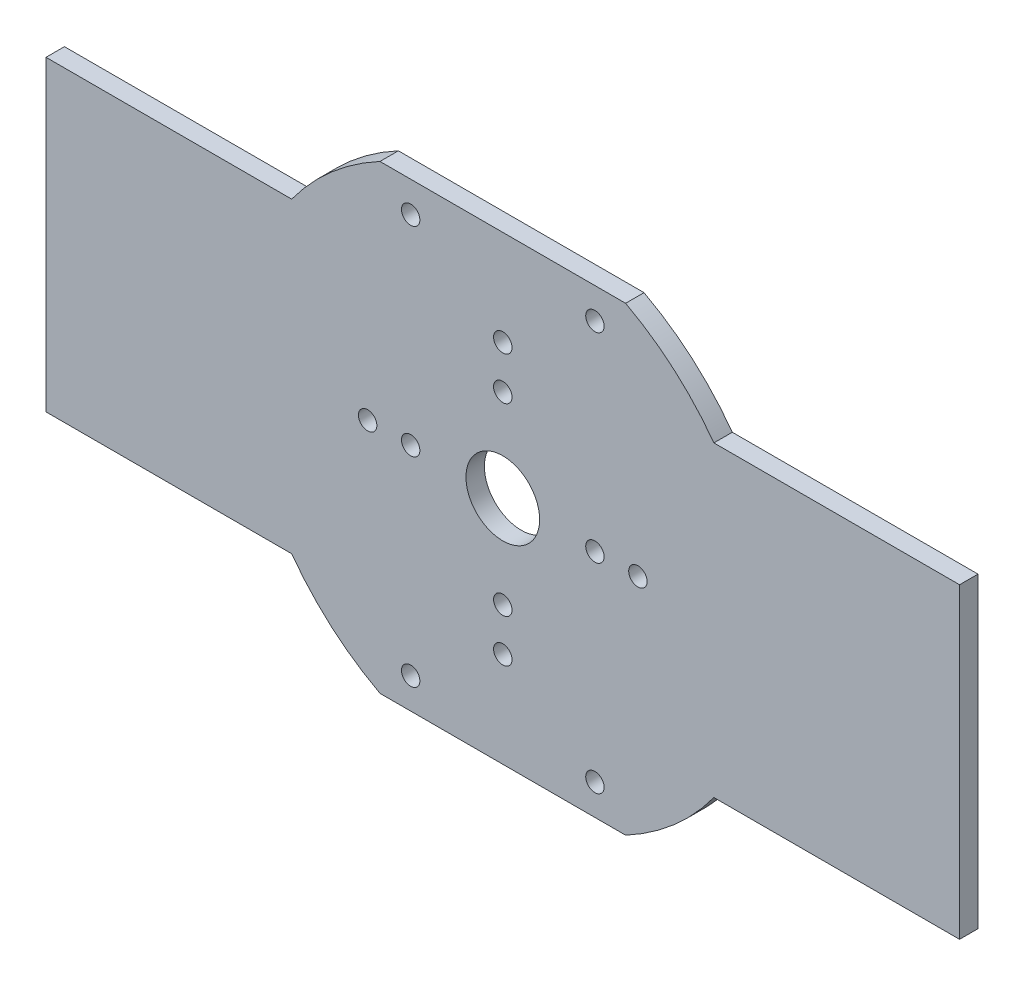
from build123d import *

# Parameters (mm, degrees)
SKETCH_1_R           = 42.5
EXTRUDE_7_DEPTH      = 1.5
CUT_EXTRUDE_24_DEPTH = 1.5
CUT_EXTRUDE_25_DEPTH = 1.5
SKETCH_1_14_R        = 1.5
CUT_EXTRUDE_26_DEPTH = 1.5
SKETCH_1_15_R        = 1.5
CUT_EXTRUDE_27_DEPTH = 1.5
SKETCH_1_16_R        = 1.5
CUT_EXTRUDE_28_DEPTH = 1.5
SKETCH_1_17_R        = 1.5
CUT_EXTRUDE_29_DEPTH = 1.5
SKETCH_10_R          = 1.5
CUT_EXTRUDE_31_DEPTH = 98.67420335
SKETCH_11_R          = 6
CUT_EXTRUDE_32_DEPTH = 98.67420335
CUT_EXTRUDE_35_DEPTH = 5
SKETCH_41_W          = 3
SKETCH_41_H          = 50
EXTRUDE_14_DEPTH     = 40
SKETCH_42_W          = 3
SKETCH_42_H          = 50
EXTRUDE_15_DEPTH     = 40


with BuildPart() as part:
    # 草图1 → 凸台-拉伸7 (new, symmetric)
    with BuildSketch(Plane.XY):
        with Locations((20, -37.5)):
            Circle(SKETCH_1_R)
    extrude(amount=EXTRUDE_7_DEPTH, both=True)

    # 草图1<12> → 切除-拉伸24 (cut, symmetric)
    with BuildSketch(Plane.XY):
        with BuildLine():
            ThreePointArc((40, 0), (20, 5), (0, 0))
            Line((0, 0), (40, 0))
        make_face()
    extrude(amount=CUT_EXTRUDE_24_DEPTH, both=True, mode=Mode.SUBTRACT)

    # 草图1<13> → 切除-拉伸25 (cut, symmetric)
    with BuildSketch(Plane.XY):
        with BuildLine():
            Line((40, -75), (0, -75))
            ThreePointArc((0, -75), (20, -80), (40, -75))
        make_face()
    extrude(amount=CUT_EXTRUDE_25_DEPTH, both=True, mode=Mode.SUBTRACT)

    # 草图1<14> → 切除-拉伸26 (cut, symmetric)
    with BuildSketch(Plane.XY):
        with Locations((5, -5)):
            Circle(SKETCH_1_14_R)
    extrude(amount=CUT_EXTRUDE_26_DEPTH, both=True, mode=Mode.SUBTRACT)

    # 草图1<15> → 切除-拉伸27 (cut, symmetric)
    with BuildSketch(Plane.XY):
        with Locations((35, -5)):
            Circle(SKETCH_1_15_R)
    extrude(amount=CUT_EXTRUDE_27_DEPTH, both=True, mode=Mode.SUBTRACT)

    # 草图1<16> → 切除-拉伸28 (cut, symmetric)
    with BuildSketch(Plane.XY):
        with Locations((5, -70)):
            Circle(SKETCH_1_16_R)
    extrude(amount=CUT_EXTRUDE_28_DEPTH, both=True, mode=Mode.SUBTRACT)

    # 草图1<17> → 切除-拉伸29 (cut, symmetric)
    with BuildSketch(Plane.XY):
        with Locations((35, -70)):
            Circle(SKETCH_1_17_R)
    extrude(amount=CUT_EXTRUDE_29_DEPTH, both=True, mode=Mode.SUBTRACT)

    # 草图10 → 切除-拉伸31 (cut, through all)
    with BuildSketch(Plane.XY.offset(1.5)):
        with Locations((20, -15.5)):
            Circle(SKETCH_10_R)
        with Locations((-2, -37.5)):
            Circle(SKETCH_10_R)
        with Locations((42, -37.5)):
            Circle(SKETCH_10_R)
        with Locations((20, -59.5)):
            Circle(SKETCH_10_R)
        with Locations((20, -22.5)):
            Circle(SKETCH_10_R)
        with Locations((5, -37.5)):
            Circle(SKETCH_10_R)
        with Locations((20, -52.5)):
            Circle(SKETCH_10_R)
        with Locations((35, -37.5)):
            Circle(SKETCH_10_R)
    extrude(amount=-CUT_EXTRUDE_31_DEPTH, mode=Mode.SUBTRACT)

    # 草图11 → 切除-拉伸32 (cut, through all)
    with BuildSketch(Plane.XY.offset(1.5)):
        with Locations((20, -37.5)):
            Circle(SKETCH_11_R)
    extrude(amount=-CUT_EXTRUDE_32_DEPTH, mode=Mode.SUBTRACT)

    # 草图19 → 切除-拉伸35 (cut, symmetric)
    with BuildSketch(Plane.XY.offset(1.5)):
        with BuildLine():
            Line((-14.369317712, -62.5), (-14.369317712, -12.5))
            ThreePointArc((-14.369317712, -12.5), (-22.5, -37.5), (-14.369317712, -62.5))
        make_face()
        with BuildLine():
            ThreePointArc((54.369317712, -62.5), (62.5, -37.5), (54.369317712, -12.5))
            Line((54.369317712, -12.5), (54.369317712, -62.5))
        make_face()
    extrude(amount=CUT_EXTRUDE_35_DEPTH, both=True, mode=Mode.SUBTRACT)

    # 草图41 → 凸台-拉伸14 (add)
    with BuildSketch(Plane(origin=(54.369317712, 0, 0), x_dir=(0, 0, -1), z_dir=(1, 0, 0))):
        with Locations((0, -37.5)):
            Rectangle(SKETCH_41_W, SKETCH_41_H)
    extrude(amount=EXTRUDE_14_DEPTH)

    # 草图42 → 凸台-拉伸15 (add)
    with BuildSketch(Plane.ZY.offset(14.369317712)):
        with Locations((0, -37.5)):
            Rectangle(SKETCH_42_W, SKETCH_42_H)
    extrude(amount=EXTRUDE_15_DEPTH)


solid = part.part
